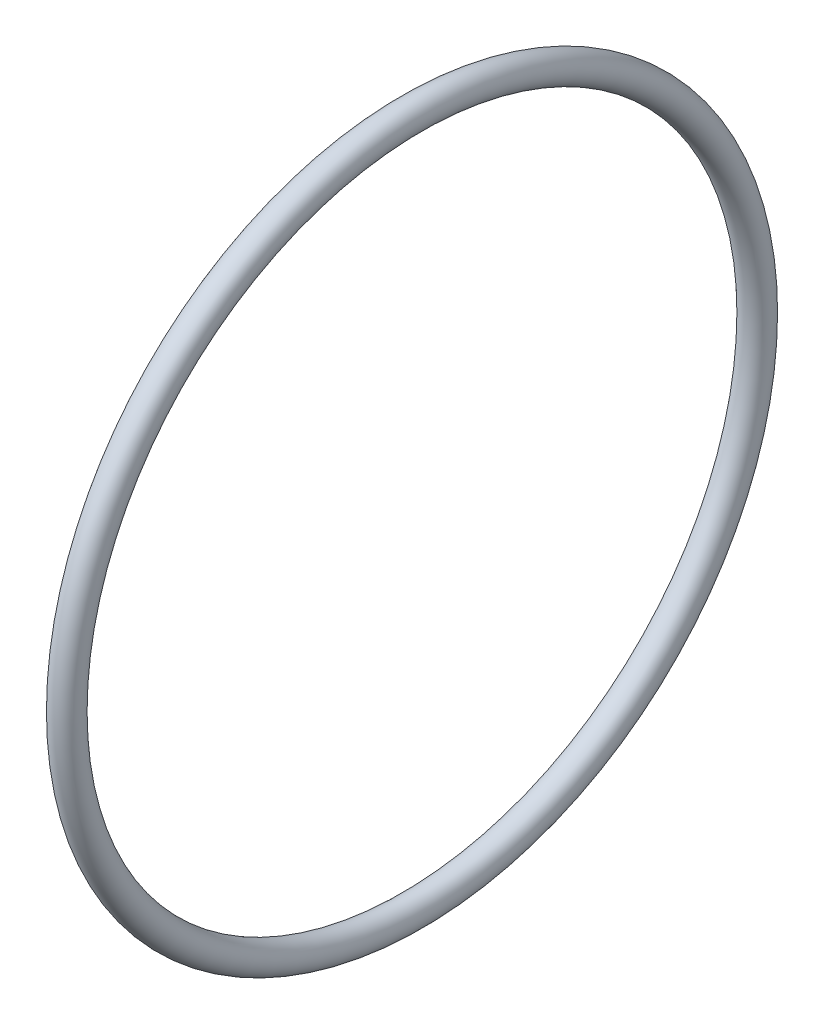
from build123d import *

# Parameters (mm, degrees)
CROQUIS1_R = 2


with BuildPart() as part:
    # Croquis1 → Revolución1 (revolve)
    with BuildSketch(Plane.XY, mode=Mode.PRIVATE) as revoluci_n1_sk:
        with Locations((0, 48)):
            Circle(CROQUIS1_R)
    revolve(revoluci_n1_sk.sketch.rotate(Axis((0, 0, 0), (1, 0, 0)), 90), axis=Axis((0, 0, 0), (1, 0, 0)))


solid = part.part
